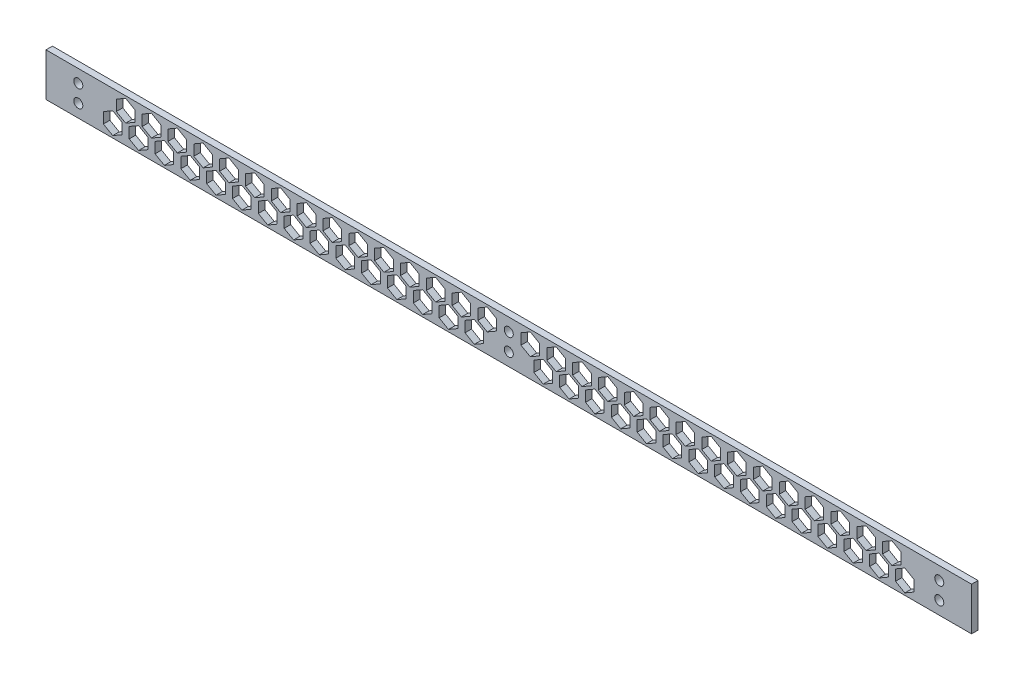
from build123d import *

# Parameters (mm, degrees)
SKETCH_2_W      = 430
SKETCH_2_H      = 20
SKETCH_2_R      = 2.1
EXTRUDE_1_DEPTH = 3


with BuildPart() as part:
    # 草图2 → 凸台-拉伸1 (new body)
    with BuildSketch(Plane.XY):
        Rectangle(SKETCH_2_W, SKETCH_2_H)
        with Locations((0, 4)):
            Circle(SKETCH_2_R, mode=Mode.SUBTRACT)
        with Locations((0, -4)):
            Circle(SKETCH_2_R, mode=Mode.SUBTRACT)
        with Locations((200, 4)):
            Circle(SKETCH_2_R, mode=Mode.SUBTRACT)
        with Locations((200, -4)):
            Circle(SKETCH_2_R, mode=Mode.SUBTRACT)
        with Locations((-200, 4)):
            Circle(SKETCH_2_R, mode=Mode.SUBTRACT)
        with Locations((-200, -4)):
            Circle(SKETCH_2_R, mode=Mode.SUBTRACT)
        Polygon((-28, -9), (-23.669872981, -6.5), (-23.669872981, -1.5), (-28, 1), (-32.330127019, -1.5), (-32.330127019, -6.5), align=None, mode=Mode.SUBTRACT)
        Polygon((-10, 9), (-14.330127019, 6.5), (-14.330127019, 1.5), (-10, -1), (-5.669872981, 1.5), (-5.669872981, 6.5), align=None, mode=Mode.SUBTRACT)
        Polygon((-16, -9), (-11.669872981, -6.5), (-11.669872981, -1.5), (-16, 1), (-20.330127019, -1.5), (-20.330127019, -6.5), align=None, mode=Mode.SUBTRACT)
        Polygon((-22, 9), (-26.330127019, 6.5), (-26.330127019, 1.5), (-22, -1), (-17.669872981, 1.5), (-17.669872981, 6.5), align=None, mode=Mode.SUBTRACT)
        Polygon((-40, -9), (-35.669872981, -6.5), (-35.669872981, -1.5), (-40, 1), (-44.330127019, -1.5), (-44.330127019, -6.5), align=None, mode=Mode.SUBTRACT)
        Polygon((-34, 9), (-38.330127019, 6.5), (-38.330127019, 1.5), (-34, -1), (-29.669872981, 1.5), (-29.669872981, 6.5), align=None, mode=Mode.SUBTRACT)
        Polygon((-52, -9), (-47.669872981, -6.5), (-47.669872981, -1.5), (-52, 1), (-56.330127019, -1.5), (-56.330127019, -6.5), align=None, mode=Mode.SUBTRACT)
        Polygon((-46, 9), (-50.330127019, 6.5), (-50.330127019, 1.5), (-46, -1), (-41.669872981, 1.5), (-41.669872981, 6.5), align=None, mode=Mode.SUBTRACT)
        Polygon((-64, -9), (-59.669872981, -6.5), (-59.669872981, -1.5), (-64, 1), (-68.330127019, -1.5), (-68.330127019, -6.5), align=None, mode=Mode.SUBTRACT)
        Polygon((-58, 9), (-62.330127019, 6.5), (-62.330127019, 1.5), (-58, -1), (-53.669872981, 1.5), (-53.669872981, 6.5), align=None, mode=Mode.SUBTRACT)
        Polygon((-76, -9), (-71.669872981, -6.5), (-71.669872981, -1.5), (-76, 1), (-80.330127019, -1.5), (-80.330127019, -6.5), align=None, mode=Mode.SUBTRACT)
        Polygon((-70, 9), (-74.330127019, 6.5), (-74.330127019, 1.5), (-70, -1), (-65.669872981, 1.5), (-65.669872981, 6.5), align=None, mode=Mode.SUBTRACT)
        Polygon((-88, -9), (-83.669872981, -6.5), (-83.669872981, -1.5), (-88, 1), (-92.330127019, -1.5), (-92.330127019, -6.5), align=None, mode=Mode.SUBTRACT)
        Polygon((-82, 9), (-86.330127019, 6.5), (-86.330127019, 1.5), (-82, -1), (-77.669872981, 1.5), (-77.669872981, 6.5), align=None, mode=Mode.SUBTRACT)
        Polygon((-100, -9), (-95.669872981, -6.5), (-95.669872981, -1.5), (-100, 1), (-104.330127019, -1.5), (-104.330127019, -6.5), align=None, mode=Mode.SUBTRACT)
        Polygon((-94, 9), (-98.330127019, 6.5), (-98.330127019, 1.5), (-94, -1), (-89.669872981, 1.5), (-89.669872981, 6.5), align=None, mode=Mode.SUBTRACT)
        Polygon((-112, -9), (-107.669872981, -6.5), (-107.669872981, -1.5), (-112, 1), (-116.330127019, -1.5), (-116.330127019, -6.5), align=None, mode=Mode.SUBTRACT)
        Polygon((-106, 9), (-110.330127019, 6.5), (-110.330127019, 1.5), (-106, -1), (-101.669872981, 1.5), (-101.669872981, 6.5), align=None, mode=Mode.SUBTRACT)
        Polygon((-124, -9), (-119.669872981, -6.5), (-119.669872981, -1.5), (-124, 1), (-128.330127019, -1.5), (-128.330127019, -6.5), align=None, mode=Mode.SUBTRACT)
        Polygon((-118, 9), (-122.330127019, 6.5), (-122.330127019, 1.5), (-118, -1), (-113.669872981, 1.5), (-113.669872981, 6.5), align=None, mode=Mode.SUBTRACT)
        Polygon((-136, -9), (-131.669872981, -6.5), (-131.669872981, -1.5), (-136, 1), (-140.330127019, -1.5), (-140.330127019, -6.5), align=None, mode=Mode.SUBTRACT)
        Polygon((-130, 9), (-134.330127019, 6.5), (-134.330127019, 1.5), (-130, -1), (-125.669872981, 1.5), (-125.669872981, 6.5), align=None, mode=Mode.SUBTRACT)
        Polygon((-148, -9), (-143.669872981, -6.5), (-143.669872981, -1.5), (-148, 1), (-152.330127019, -1.5), (-152.330127019, -6.5), align=None, mode=Mode.SUBTRACT)
        Polygon((-142, 9), (-146.330127019, 6.5), (-146.330127019, 1.5), (-142, -1), (-137.669872981, 1.5), (-137.669872981, 6.5), align=None, mode=Mode.SUBTRACT)
        Polygon((-160, -9), (-155.669872981, -6.5), (-155.669872981, -1.5), (-160, 1), (-164.330127019, -1.5), (-164.330127019, -6.5), align=None, mode=Mode.SUBTRACT)
        Polygon((-154, 9), (-158.330127019, 6.5), (-158.330127019, 1.5), (-154, -1), (-149.669872981, 1.5), (-149.669872981, 6.5), align=None, mode=Mode.SUBTRACT)
        Polygon((-172, -9), (-167.669872981, -6.5), (-167.669872981, -1.5), (-172, 1), (-176.330127019, -1.5), (-176.330127019, -6.5), align=None, mode=Mode.SUBTRACT)
        Polygon((-166, 9), (-170.330127019, 6.5), (-170.330127019, 1.5), (-166, -1), (-161.669872981, 1.5), (-161.669872981, 6.5), align=None, mode=Mode.SUBTRACT)
        Polygon((-184, -9), (-179.669872981, -6.5), (-179.669872981, -1.5), (-184, 1), (-188.330127019, -1.5), (-188.330127019, -6.5), align=None, mode=Mode.SUBTRACT)
        Polygon((-178, 9), (-182.330127019, 6.5), (-182.330127019, 1.5), (-178, -1), (-173.669872981, 1.5), (-173.669872981, 6.5), align=None, mode=Mode.SUBTRACT)
        Polygon((5.669872981, 6.5), (10, 9), (14.330127019, 6.5), (14.330127019, 1.5), (10, -1), (5.669872981, 1.5), align=None, mode=Mode.SUBTRACT)
        Polygon((20.330127019, -6.5), (16, -9), (11.669872981, -6.5), (11.669872981, -1.5), (16, 1), (20.330127019, -1.5), align=None, mode=Mode.SUBTRACT)
        Polygon((17.669872981, 6.5), (22, 9), (26.330127019, 6.5), (26.330127019, 1.5), (22, -1), (17.669872981, 1.5), align=None, mode=Mode.SUBTRACT)
        Polygon((32.330127019, -6.5), (28, -9), (23.669872981, -6.5), (23.669872981, -1.5), (28, 1), (32.330127019, -1.5), align=None, mode=Mode.SUBTRACT)
        Polygon((29.669872981, 6.5), (34, 9), (38.330127019, 6.5), (38.330127019, 1.5), (34, -1), (29.669872981, 1.5), align=None, mode=Mode.SUBTRACT)
        Polygon((44.330127019, -6.5), (40, -9), (35.669872981, -6.5), (35.669872981, -1.5), (40, 1), (44.330127019, -1.5), align=None, mode=Mode.SUBTRACT)
        Polygon((56.330127019, -6.5), (52, -9), (47.669872981, -6.5), (47.669872981, -1.5), (52, 1), (56.330127019, -1.5), align=None, mode=Mode.SUBTRACT)
        Polygon((41.669872981, 6.5), (46, 9), (50.330127019, 6.5), (50.330127019, 1.5), (46, -1), (41.669872981, 1.5), align=None, mode=Mode.SUBTRACT)
        Polygon((53.669872981, 6.5), (58, 9), (62.330127019, 6.5), (62.330127019, 1.5), (58, -1), (53.669872981, 1.5), align=None, mode=Mode.SUBTRACT)
        Polygon((68.330127019, -6.5), (64, -9), (59.669872981, -6.5), (59.669872981, -1.5), (64, 1), (68.330127019, -1.5), align=None, mode=Mode.SUBTRACT)
        Polygon((80.330127019, -6.5), (76, -9), (71.669872981, -6.5), (71.669872981, -1.5), (76, 1), (80.330127019, -1.5), align=None, mode=Mode.SUBTRACT)
        Polygon((65.669872981, 6.5), (70, 9), (74.330127019, 6.5), (74.330127019, 1.5), (70, -1), (65.669872981, 1.5), align=None, mode=Mode.SUBTRACT)
        Polygon((77.669872981, 6.5), (82, 9), (86.330127019, 6.5), (86.330127019, 1.5), (82, -1), (77.669872981, 1.5), align=None, mode=Mode.SUBTRACT)
        Polygon((92.330127019, -6.5), (88, -9), (83.669872981, -6.5), (83.669872981, -1.5), (88, 1), (92.330127019, -1.5), align=None, mode=Mode.SUBTRACT)
        Polygon((89.669872981, 6.5), (94, 9), (98.330127019, 6.5), (98.330127019, 1.5), (94, -1), (89.669872981, 1.5), align=None, mode=Mode.SUBTRACT)
        Polygon((104.330127019, -6.5), (100, -9), (95.669872981, -6.5), (95.669872981, -1.5), (100, 1), (104.330127019, -1.5), align=None, mode=Mode.SUBTRACT)
        Polygon((101.669872981, 6.5), (106, 9), (110.330127019, 6.5), (110.330127019, 1.5), (106, -1), (101.669872981, 1.5), align=None, mode=Mode.SUBTRACT)
        Polygon((116.330127019, -6.5), (112, -9), (107.669872981, -6.5), (107.669872981, -1.5), (112, 1), (116.330127019, -1.5), align=None, mode=Mode.SUBTRACT)
        Polygon((113.669872981, 6.5), (118, 9), (122.330127019, 6.5), (122.330127019, 1.5), (118, -1), (113.669872981, 1.5), align=None, mode=Mode.SUBTRACT)
        Polygon((128.330127019, -6.5), (124, -9), (119.669872981, -6.5), (119.669872981, -1.5), (124, 1), (128.330127019, -1.5), align=None, mode=Mode.SUBTRACT)
        Polygon((125.669872981, 6.5), (130, 9), (134.330127019, 6.5), (134.330127019, 1.5), (130, -1), (125.669872981, 1.5), align=None, mode=Mode.SUBTRACT)
        Polygon((140.330127019, -6.5), (136, -9), (131.669872981, -6.5), (131.669872981, -1.5), (136, 1), (140.330127019, -1.5), align=None, mode=Mode.SUBTRACT)
        Polygon((137.669872981, 6.5), (142, 9), (146.330127019, 6.5), (146.330127019, 1.5), (142, -1), (137.669872981, 1.5), align=None, mode=Mode.SUBTRACT)
        Polygon((152.330127019, -6.5), (148, -9), (143.669872981, -6.5), (143.669872981, -1.5), (148, 1), (152.330127019, -1.5), align=None, mode=Mode.SUBTRACT)
        Polygon((149.669872981, 6.5), (154, 9), (158.330127019, 6.5), (158.330127019, 1.5), (154, -1), (149.669872981, 1.5), align=None, mode=Mode.SUBTRACT)
        Polygon((164.330127019, -6.5), (160, -9), (155.669872981, -6.5), (155.669872981, -1.5), (160, 1), (164.330127019, -1.5), align=None, mode=Mode.SUBTRACT)
        Polygon((161.669872981, 6.5), (166, 9), (170.330127019, 6.5), (170.330127019, 1.5), (166, -1), (161.669872981, 1.5), align=None, mode=Mode.SUBTRACT)
        Polygon((176.330127019, -6.5), (172, -9), (167.669872981, -6.5), (167.669872981, -1.5), (172, 1), (176.330127019, -1.5), align=None, mode=Mode.SUBTRACT)
        Polygon((188.330127019, -6.5), (184, -9), (179.669872981, -6.5), (179.669872981, -1.5), (184, 1), (188.330127019, -1.5), align=None, mode=Mode.SUBTRACT)
        Polygon((173.669872981, 6.5), (178, 9), (182.330127019, 6.5), (182.330127019, 1.5), (178, -1), (173.669872981, 1.5), align=None, mode=Mode.SUBTRACT)
    extrude(amount=EXTRUDE_1_DEPTH)


solid = part.part
